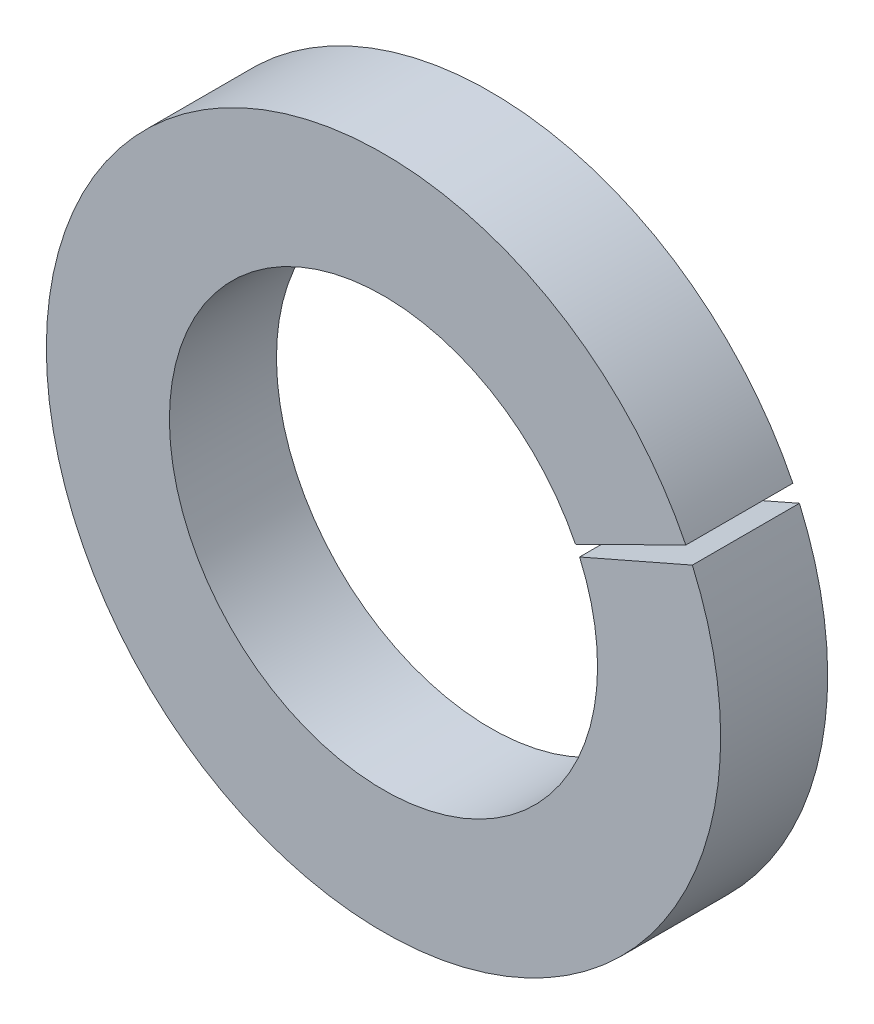
from build123d import *

# Parameters (mm, degrees)
SKETCH_1_R          = 3.15
SKETCH_1_R_2        = 2
EXTRUDE_1_DEPTH     = 1
CUT_EXTRUDE_1_DEPTH = 10


with BuildPart() as part:
    # 草图1 → 凸台-拉伸1 (new body)
    with BuildSketch(Plane.XY):
        Circle(SKETCH_1_R)
        Circle(SKETCH_1_R_2, mode=Mode.SUBTRACT)
    extrude(amount=EXTRUDE_1_DEPTH)

    # 草图2 → 切除-拉伸1 (cut)
    with BuildSketch(Plane.XY.offset(1)):
        Polygon((0, 0), (4.812459265, 2.375572201), (4.812459265, 2.105870497), align=None)
    extrude(amount=-CUT_EXTRUDE_1_DEPTH, mode=Mode.SUBTRACT)


solid = part.part
